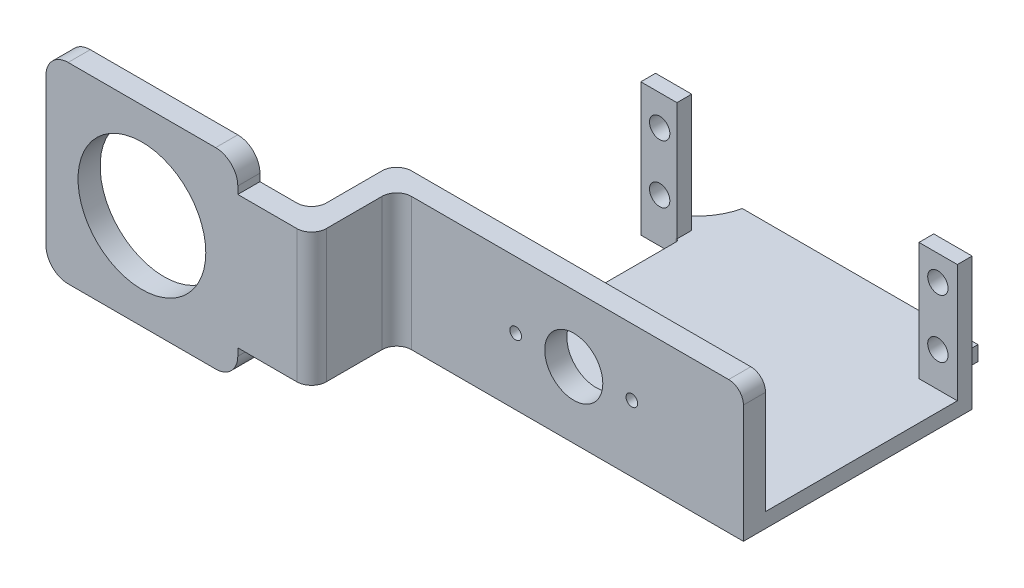
from build123d import *

# Parameters (mm, degrees)
SKETCH2_W            = 47.895999966
SKETCH2_H            = 27.94
BOSS_EXTRUDE1_DEPTH  = 2.54
SKETCH4_W            = 6.604
SKETCH4_H            = 2.54
BOSS_EXTRUDE7_DEPTH  = 22.86
SKETCH22_W           = 41.291999966
SKETCH22_H           = 2.54
BOSS_EXTRUDE9_DEPTH  = 10.16
SKETCH23_W           = 7.62
SKETCH23_H           = 2.54
BOSS_EXTRUDE10_DEPTH = 6.604
SKETCH24_W           = 7.62
SKETCH24_H           = 2.54
BOSS_EXTRUDE11_DEPTH = 6.604
CUT_EXTRUDE2_DEPTH   = 6.604
SKETCH26_R           = 1.75
CUT_EXTRUDE3_DEPTH   = 6.604
SKETCH28_W           = 0.381
SKETCH28_H           = 20.32
CUT_EXTRUDE4_DEPTH   = 6.604
SKETCH29_W           = 47.895999966
SKETCH29_H           = 2.54
BOSS_EXTRUDE12_DEPTH = 5.08
SKETCH31_W           = 3.81
SKETCH31_H           = 10.853375152
BOSS_EXTRUDE13_DEPTH = 22.86
SKETCH32_W           = 3.81
SKETCH32_H           = 33.02
BOSS_EXTRUDE14_DEPTH = 33.02
SKETCH33_R           = 5
SKETCH33_R_2         = 1
CUT_EXTRUDE5_DEPTH   = 9.144
SKETCH34_R           = 11
CUT_EXTRUDE6_DEPTH   = 9.144
FILLET6_R            = 2.54
FILLET7_R            = 3.81
BOSS_EXTRUDE15_DEPTH = 2.54


with BuildPart() as part:
    # Sketch2 → Boss-Extrude1 (new body)
    with BuildSketch(Plane(origin=(0, 0, 0), x_dir=(1, 0, 0), z_dir=(0, 1, 0))):
        with Locations((-1397.315525756, 385.150412371)):
            Rectangle(SKETCH2_W, SKETCH2_H)
    extrude(amount=BOSS_EXTRUDE1_DEPTH)

    # Sketch4 → Boss-Extrude7 (add)
    with BuildSketch(Plane.XZ):
        with Locations((-1424.565525739, -400.390412371)):
            Rectangle(SKETCH4_W, SKETCH4_H)
        with Locations((-1376.669525773, -400.390412371)):
            Rectangle(SKETCH4_W, SKETCH4_H)
    extrude(amount=-BOSS_EXTRUDE7_DEPTH)


with BuildPart() as boss_extrude7_piece_1:
    # of the separate pieces the step leaves, piece 1, a body of its own (boss_extrude7_pieces)
    add(part.part.solids().sort_by_distance((-1379.971525773, 0, -399.120412371))[0])



with BuildPart() as boss_extrude7_piece_2:
    # of the separate pieces the step leaves, piece 2, a body of its own (boss_extrude7_pieces)
    add(part.part.solids().sort_by_distance((-1421.263525739, 22.86, -399.120412371))[0])


with BuildPart() as boss_extrude7_piece_1_1:
    add(boss_extrude7_piece_1.part)

    add(boss_extrude7_piece_2.part)  # Boss-Extrude9 merges Boss-Extrude7 piece 2
    # Sketch22 → Boss-Extrude9 (add)
    with BuildSketch(Plane(origin=(0, 0, -399.120412371), x_dir=(-1, 0, 0), z_dir=(0, 0, -1))):
        with Locations((1400.617525756, 1.27)):
            Rectangle(SKETCH22_W, SKETCH22_H)
    extrude(amount=BOSS_EXTRUDE9_DEPTH)

    # Sketch23 → Boss-Extrude10 (add)
    with BuildSketch(Plane(origin=(-1379.971525773, 0, 0), x_dir=(0, 0, -1), z_dir=(1, 0, 0))):
        with Locations((405.470412371, 1.27)):
            Rectangle(SKETCH23_W, SKETCH23_H)
    extrude(amount=BOSS_EXTRUDE10_DEPTH)

    # Sketch24 → Boss-Extrude11 (add)
    with BuildSketch(Plane.ZY.offset(1421.263525739)):
        with Locations((-405.470412371, 1.27)):
            Rectangle(SKETCH24_W, SKETCH24_H)
    extrude(amount=BOSS_EXTRUDE11_DEPTH)

    # Sketch25 → Cut-Extrude2 (cut)
    with BuildSketch(Plane(origin=(0, 2.54, 0), x_dir=(1, 0, 0), z_dir=(0, 1, 0))):
        with BuildLine():
            Line((-1420.553753649, 409.280412371), (-1427.867525739, 409.280412371))
            Line((-1427.867525739, 409.280412371), (-1427.867525739, 401.660412371))
            ThreePointArc((-1427.867525739, 401.660412371), (-1423.137532321, 404.440430382), (-1420.553753649, 409.280412371))
        make_face()
        with BuildLine():
            Line((-1379.971525773, 409.280412371), (-1373.367525773, 409.280412371))
            Line((-1373.367525773, 409.280412371), (-1373.367525773, 401.660412371))
            ThreePointArc((-1373.367525773, 401.660412371), (-1378.247679446, 404.102679188), (-1379.971525773, 409.280412371))
        make_face()
    extrude(amount=-CUT_EXTRUDE2_DEPTH, mode=Mode.SUBTRACT)

    # Sketch26 → Cut-Extrude3 (cut)
    with BuildSketch(Plane.XY.offset(-399.120412371)):
        with Locations((-1424.617525739, 17.61)):
            Circle(SKETCH26_R)
        with Locations((-1424.617525739, 7.61)):
            Circle(SKETCH26_R)
        with Locations((-1376.721525773, 18.514296447)):
            Circle(SKETCH26_R)
        with Locations((-1376.721525773, 8.514296447)):
            Circle(SKETCH26_R)
    extrude(amount=-CUT_EXTRUDE3_DEPTH, mode=Mode.SUBTRACT)

    # Sketch28 → Cut-Extrude4 (cut)
    with BuildSketch(Plane.XY.offset(-399.120412371)):
        with Locations((-1421.454025739, 12.7)):
            Rectangle(SKETCH28_W, SKETCH28_H)
    extrude(amount=-CUT_EXTRUDE4_DEPTH, mode=Mode.SUBTRACT)

    # Sketch29 → Boss-Extrude12 (add)
    with BuildSketch(Plane.XY.offset(-371.180412371)):
        with Locations((-1397.315525756, 1.27)):
            Rectangle(SKETCH29_W, SKETCH29_H)
    extrude(amount=BOSS_EXTRUDE12_DEPTH)

    # Sketch31 → Boss-Extrude13 (add)
    with BuildSketch(Plane.XZ):
        Polygon((-1421.263525739, -366.100412371), (-1373.367525773, -366.100412371), (-1373.367525773, -362.290412371), (-1433.057525773, -362.290412371), (-1436.867525773, -362.290412371), (-1436.867525773, -366.100412371), align=None)
        with Locations((-1434.962525773, -356.863724795)):
            Rectangle(SKETCH31_W, SKETCH31_H)
        Polygon((-1436.867525773, -351.437037219), (-1433.057525773, -351.437037219), (-1433.057525773, -347.627037219), (-1445.757525773, -347.627037219), (-1445.757525773, -351.437037219), align=None)
    extrude(amount=-BOSS_EXTRUDE13_DEPTH)

    # Sketch32 → Boss-Extrude14 (add)
    with BuildSketch(Plane.ZY.offset(1445.757525773)):
        with Locations((-349.532037219, 11.43)):
            Rectangle(SKETCH32_W, SKETCH32_H)
    extrude(amount=BOSS_EXTRUDE14_DEPTH)

    # Sketch33 → Cut-Extrude5 (cut)
    with BuildSketch(Plane.XY.offset(-362.290412371)):
        with Locations((-1402.577525773, 11.43)):
            Circle(SKETCH33_R)
        with Locations((-1412.577525773, 11.43)):
            Circle(SKETCH33_R_2)
        with Locations((-1392.577525773, 11.43)):
            Circle(SKETCH33_R_2)
    extrude(amount=-CUT_EXTRUDE5_DEPTH, mode=Mode.SUBTRACT)

    # Sketch34 → Cut-Extrude6 (cut)
    with BuildSketch(Plane.XY.offset(-347.627037219)):
        with Locations((-1462.267525773, 11.43)):
            Circle(SKETCH34_R)
    extrude(amount=-CUT_EXTRUDE6_DEPTH, mode=Mode.SUBTRACT)

    # Fillet6
    fillet6_edges = [boss_extrude7_piece_1_1.edges().sort_by_distance(p)[0] for p in [
        (-1421.263525739, 1.27, -366.100412371),
        (-1436.867525773, 11.43, -366.100412371),
        (-1436.867525773, 11.43, -351.437037219),
        (-1433.057525773, 11.43, -347.627037219),
        (-1433.057525773, 11.43, -362.290412371),
        (-1373.367525773, 22.86, -364.195412371),
    ]]
    fillet(fillet6_edges, radius=FILLET6_R)

    # Fillet7
    fillet7_edges = [boss_extrude7_piece_1_1.edges().sort_by_distance(p)[0] for p in [
        (-1445.757525773, -5.08, -349.532037219),
        (-1445.757525773, 27.94, -349.532037219),
        (-1478.777525773, -5.08, -349.532037219),
        (-1478.777525773, 27.94, -349.532037219),
    ]]
    fillet(fillet7_edges, radius=FILLET7_R)

    # Sketch35 → Boss-Extrude15 (add)
    with BuildSketch(Plane(origin=(0, 2.54, 0), x_dir=(1, 0, 0), z_dir=(0, 1, 0))):
        with BuildLine():
            Line((-1421.263525739, 399.120412371), (-1421.771525739, 399.120412371))
            ThreePointArc((-1421.771525739, 399.120412371), (-1421.412315494, 398.971622616), (-1421.263525739, 398.612412371))
            Line((-1421.263525739, 398.612412371), (-1421.263525739, 399.120412371))
        make_face()
    extrude(amount=-BOSS_EXTRUDE15_DEPTH)


solid = boss_extrude7_piece_1_1.part
